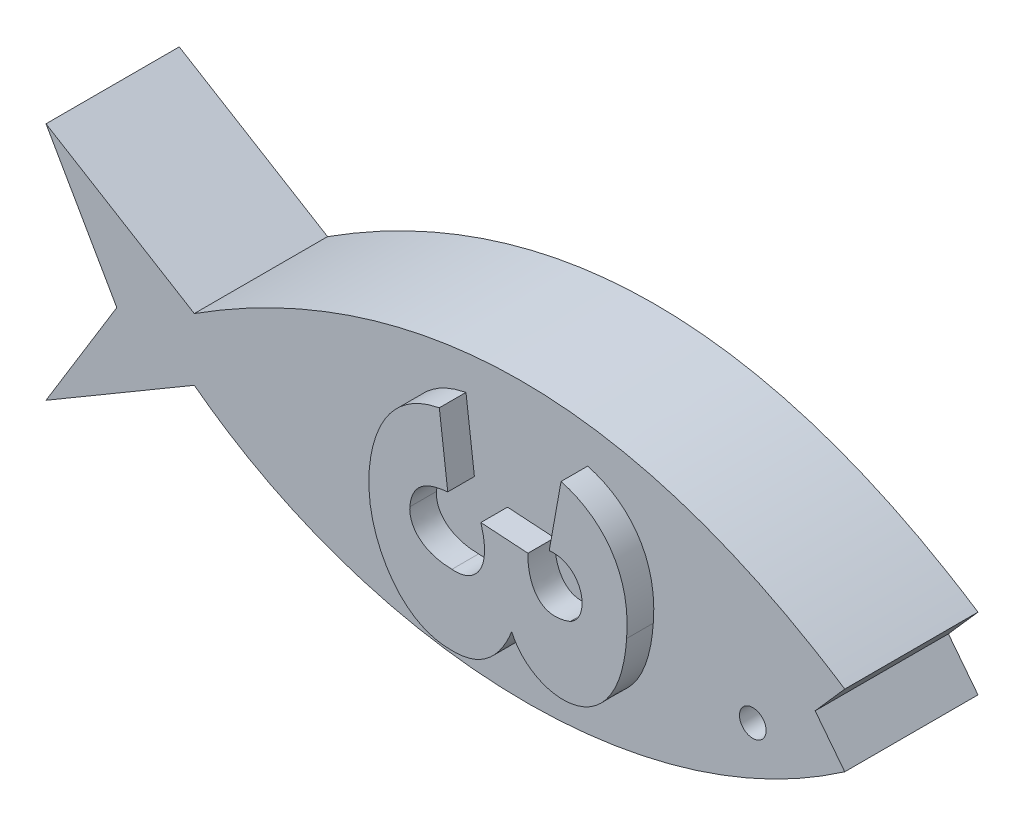
from build123d import *

# Parameters (mm, degrees)
SKETCH2_R           = 0.500109693
BOSS_EXTRUDE1_DEPTH = 5
BOSS_EXTRUDE2_DEPTH = 1


with BuildPart() as part:
    # Sketch2 → Boss-Extrude1 (new body)
    with BuildSketch(Plane(origin=(0, 0, 0), x_dir=(1, 0, 0), z_dir=(0, 0, -1))):
        with BuildLine():
            Line((29.97295835, 6.642737104), (28.862437793, 5.215722686))
            Line((28.862437793, 5.215722686), (29.97295835, 3.953817374))
            add(Edge.make_bspline(
                [(5.565346412, 3.953817374), (17.919076804, -3.939717318), (29.97295835, 3.953817374)],
                knots=[0, 0, 0, 1, 1, 1], degree=2))
            Line((5.565346412, 3.953817374), (0, 0.570103483))
            Line((0, 0.570103483), (2.65645961, 5.215722686))
            Line((2.65645961, 5.215722686), (0, 9.556126627))
            Line((0, 9.556126627), (5.565346412, 6.285726684))
            add(Edge.make_bspline(
                [(5.565346412, 6.285726684), (12.037313538, 11.217277608), (22.14175538, 12.07873787), (29.97295835, 6.642737104)],
                knots=[0, 0, 0, 0, 1, 1, 1, 1], degree=3))
        make_face()
        with Locations(Location((26.5225963, 6.780666166, 0), (0, 0, 180))):
            Circle(SKETCH2_R, mode=Mode.SUBTRACT)
    extrude(amount=-BOSS_EXTRUDE1_DEPTH)

    # Sketch6 → Boss-Extrude2 (add)
    with BuildSketch(Plane(origin=(0, 0, 5), x_dir=(-1, 0, 0), z_dir=(0, 0, 1))):
        with BuildLine():
            Line((-15.759449442, 1.418953032), (-16.07584813, 3.995005952))
            add(Edge.make_bspline(
                [(-16.07584813, 3.995005952), (-15.458880746, 4.062710088), (-14.740919917, 4.238390229), (-14.650433604, 5.193040536)],
                knots=[0, 0, 0, 0, 1, 1, 1, 1], degree=3))
            add(Edge.make_bspline(
                [(-14.650433604, 5.193040536), (-14.619231687, 5.862120963), (-15.169780731, 6.414980417), (-16.232102989, 6.432436177)],
                knots=[0, 0, 0, 0, 1, 1, 1, 1], degree=3))
            add(Edge.make_bspline(
                [(-16.232102989, 6.432436177), (-17.005188221, 6.511841439), (-17.780119933, 5.869895845), (-17.317691742, 4.369140076)],
                knots=[0, 0, 0, 0, 1, 1, 1, 1], degree=3))
            Line((-17.317691742, 4.369140076), (-19.0853994, 4.482638032))
            add(Edge.make_bspline(
                [(-19.0853994, 4.482638032), (-19.056118502, 4.997195312), (-19.258203254, 6.439044313), (-20.66941937, 5.911436499)],
                knots=[0, 0, 0, 0, 1, 1, 1, 1], degree=3))
            add(Edge.make_bspline(
                [(-20.66941937, 5.911436499), (-21.486344473, 5.457892375), (-21.162251573, 3.883318696), (-19.884325096, 3.995005952)],
                knots=[0, 0, 0, 0, 1, 1, 1, 1], degree=3))
            Line((-19.884325096, 3.995005952), (-20.327479071, 1.52976102))
            add(Edge.make_bspline(
                [(-22.787674533, 5.404891959), (-22.963836678, 3.337144225), (-21.949807027, 1.978010395), (-20.327479071, 1.52976102)],
                knots=[0, 0, 0, 0, 1, 1, 1, 1], degree=3))
            add(Edge.make_bspline(
                [(-18.474874193, 7.338129926), (-19.24932143, 9.101790183), (-22.509278972, 9.429289769), (-22.787674533, 5.404891959)],
                knots=[0, 0, 0, 0, 1, 1, 1, 1], degree=3))
            add(Edge.make_bspline(
                [(-16.07584813, 9.06636742), (-17.73342296, 9.193466544), (-18.474874193, 7.338129926)],
                knots=[0, 0, 0, 1, 1, 1], degree=2))
            add(Edge.make_bspline(
                [(-13.123671188, 5.404891959), (-13.173598197, 6.971888977), (-14.244410718, 9.017312988), (-16.07584813, 9.06636742)],
                knots=[0, 0, 0, 0, 1, 1, 1, 1], degree=3))
            add(Edge.make_bspline(
                [(-15.759449442, 1.418953032), (-13.321402819, 1.889445376), (-13.053480895, 4.428709713), (-13.123671188, 5.404891959)],
                knots=[0, 0, 0, 0, 1, 1, 1, 1], degree=3))
        make_face()
    extrude(amount=BOSS_EXTRUDE2_DEPTH)


solid = part.part
